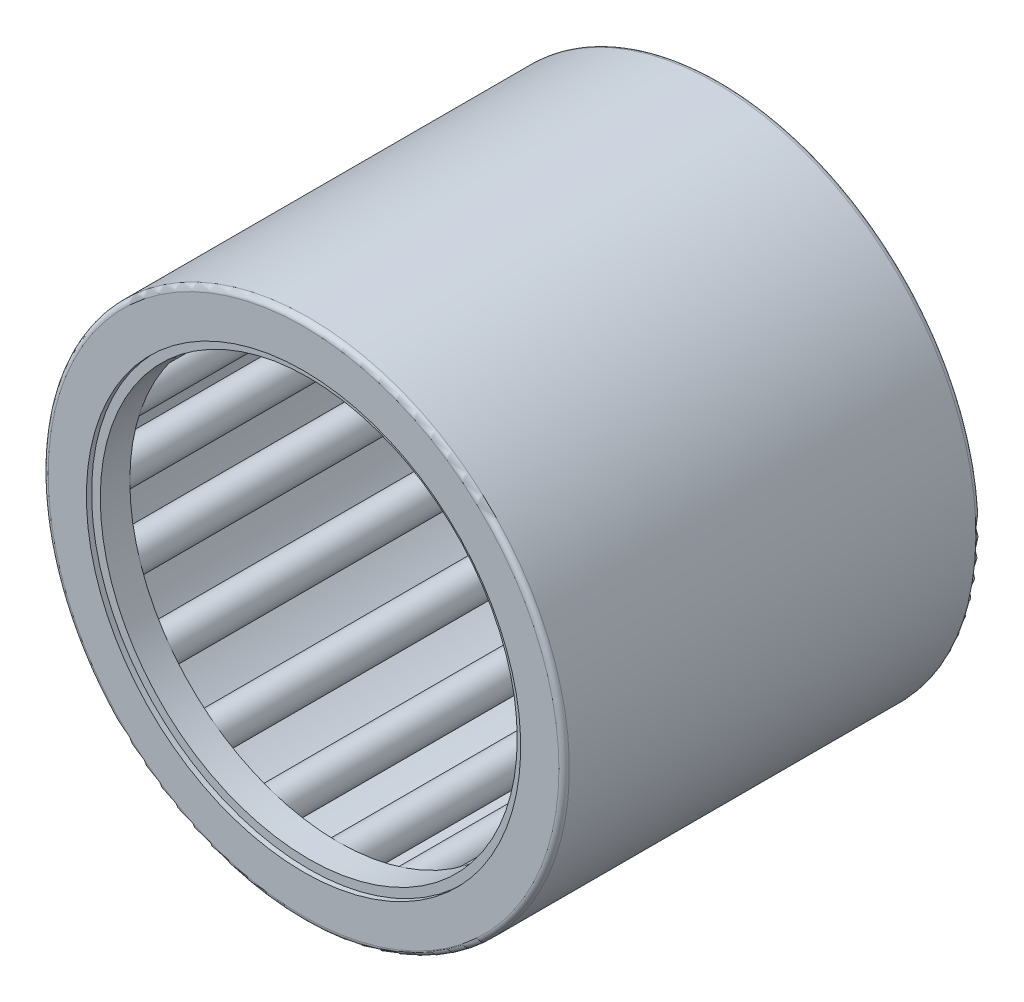
from build123d import *

# Parameters (mm, degrees)
SKETCH2_W         = 21.166666666
SKETCH2_H         = 0.79375
SKETCH3_W         = 23.283333334
SKETCH3_H         = 0.264583334
CIRPATTERN1_COUNT = 20
CIRPATTERN1_ANGLE = 342
FILLET1_R         = 0.3175
SKETCH4_W         = 1.799166667
SKETCH4_H         = 0.529166667
SKETCH5_W         = 1.799166667
SKETCH5_H         = 0.529166667


with BuildPart() as part:
    # Sketch1 → Revolve1 (revolve)
    with BuildSketch(Plane(origin=(0, 0, 0), x_dir=(0, 0, -1), z_dir=(1, 0, 0)), mode=Mode.PRIVATE) as revolve1_sk:
        Polygon((-12.7, 15.875), (12.7, 15.875), (12.7, 13.229166667), (11.641666667, 13.229166667), (11.641666667, 14.816666667), (-11.641666667, 14.816666667), (-11.641666667, 13.229166667), (-12.7, 13.229166667), align=None)
    revolve(revolve1_sk.sketch.rotate(Axis((0, 0, 12.7), (0, 0, -1)), 180), axis=Axis((0, 0, 12.7), (0, 0, -1)))

    # Fillet1
    fillet1_edges = [part.edges().sort_by_distance(p)[0] for p in [
        (0, 15.875, 12.7),
        (0, 15.875, -12.7),
    ]]
    fillet(fillet1_edges, radius=FILLET1_R)


with BuildPart() as body_2:
    # Sketch2 → Revolve2 (revolve)
    with BuildSketch(Plane(origin=(0, 0, 0), x_dir=(0, 0, -1), z_dir=(1, 0, 0)), mode=Mode.PRIVATE) as revolve2_sk:
        with Locations((0, 14.419791667)):
            Rectangle(SKETCH2_W, SKETCH2_H)
    revolve(revolve2_sk.sketch.rotate(Axis((0, 13.758333333, 10.583333333), (0, 0, -1)), 180), axis=Axis((0, 13.758333333, 10.583333333), (0, 0, -1)))


with BuildPart() as body_3:
    # Sketch3 → Revolve3 (revolve)
    with BuildSketch(Plane(origin=(0, 0, 0), x_dir=(0, 0, -1), z_dir=(1, 0, 0)), mode=Mode.PRIVATE) as revolve3_sk:
        with Locations((0, 13.890625)):
            Rectangle(SKETCH3_W, SKETCH3_H)
    revolve(revolve3_sk.sketch.rotate(Axis((0, 13.758333333, 11.641666667), (0, 0, -1)), 90), axis=Axis((0, 13.758333333, 11.641666667), (0, 0, -1)))


with BuildPart() as cirpattern1_1:
    # CirPattern1: pattern copy
    add(body_2.part.rotate(Axis((0, 0, -12.7), (0, 0, 1)), 1 * CIRPATTERN1_ANGLE / (CIRPATTERN1_COUNT - 1)))


with BuildPart() as cirpattern1_2:
    # CirPattern1: pattern copy
    add(body_2.part.rotate(Axis((0, 0, -12.7), (0, 0, 1)), 2 * CIRPATTERN1_ANGLE / (CIRPATTERN1_COUNT - 1)))


with BuildPart() as cirpattern1_3:
    # CirPattern1: pattern copy
    add(body_2.part.rotate(Axis((0, 0, -12.7), (0, 0, 1)), 3 * CIRPATTERN1_ANGLE / (CIRPATTERN1_COUNT - 1)))


with BuildPart() as cirpattern1_4:
    # CirPattern1: pattern copy
    add(body_2.part.rotate(Axis((0, 0, -12.7), (0, 0, 1)), 4 * CIRPATTERN1_ANGLE / (CIRPATTERN1_COUNT - 1)))


with BuildPart() as cirpattern1_5:
    # CirPattern1: pattern copy
    add(body_2.part.rotate(Axis((0, 0, -12.7), (0, 0, 1)), 5 * CIRPATTERN1_ANGLE / (CIRPATTERN1_COUNT - 1)))


with BuildPart() as cirpattern1_6:
    # CirPattern1: pattern copy
    add(body_2.part.rotate(Axis((0, 0, -12.7), (0, 0, 1)), 6 * CIRPATTERN1_ANGLE / (CIRPATTERN1_COUNT - 1)))


with BuildPart() as cirpattern1_7:
    # CirPattern1: pattern copy
    add(body_2.part.rotate(Axis((0, 0, -12.7), (0, 0, 1)), 7 * CIRPATTERN1_ANGLE / (CIRPATTERN1_COUNT - 1)))


with BuildPart() as cirpattern1_8:
    # CirPattern1: pattern copy
    add(body_2.part.rotate(Axis((0, 0, -12.7), (0, 0, 1)), 8 * CIRPATTERN1_ANGLE / (CIRPATTERN1_COUNT - 1)))


with BuildPart() as cirpattern1_9:
    # CirPattern1: pattern copy
    add(body_2.part.rotate(Axis((0, 0, -12.7), (0, 0, 1)), 9 * CIRPATTERN1_ANGLE / (CIRPATTERN1_COUNT - 1)))


with BuildPart() as cirpattern1_10:
    # CirPattern1: pattern copy
    add(body_2.part.rotate(Axis((0, 0, -12.7), (0, 0, 1)), 10 * CIRPATTERN1_ANGLE / (CIRPATTERN1_COUNT - 1)))


with BuildPart() as cirpattern1_11:
    # CirPattern1: pattern copy
    add(body_2.part.rotate(Axis((0, 0, -12.7), (0, 0, 1)), 11 * CIRPATTERN1_ANGLE / (CIRPATTERN1_COUNT - 1)))


with BuildPart() as cirpattern1_12:
    # CirPattern1: pattern copy
    add(body_2.part.rotate(Axis((0, 0, -12.7), (0, 0, 1)), 12 * CIRPATTERN1_ANGLE / (CIRPATTERN1_COUNT - 1)))


with BuildPart() as cirpattern1_13:
    # CirPattern1: pattern copy
    add(body_2.part.rotate(Axis((0, 0, -12.7), (0, 0, 1)), 13 * CIRPATTERN1_ANGLE / (CIRPATTERN1_COUNT - 1)))


with BuildPart() as cirpattern1_14:
    # CirPattern1: pattern copy
    add(body_2.part.rotate(Axis((0, 0, -12.7), (0, 0, 1)), 14 * CIRPATTERN1_ANGLE / (CIRPATTERN1_COUNT - 1)))


with BuildPart() as cirpattern1_15:
    # CirPattern1: pattern copy
    add(body_2.part.rotate(Axis((0, 0, -12.7), (0, 0, 1)), 15 * CIRPATTERN1_ANGLE / (CIRPATTERN1_COUNT - 1)))


with BuildPart() as cirpattern1_16:
    # CirPattern1: pattern copy
    add(body_2.part.rotate(Axis((0, 0, -12.7), (0, 0, 1)), 16 * CIRPATTERN1_ANGLE / (CIRPATTERN1_COUNT - 1)))


with BuildPart() as cirpattern1_17:
    # CirPattern1: pattern copy
    add(body_2.part.rotate(Axis((0, 0, -12.7), (0, 0, 1)), 17 * CIRPATTERN1_ANGLE / (CIRPATTERN1_COUNT - 1)))


with BuildPart() as cirpattern1_18:
    # CirPattern1: pattern copy
    add(body_2.part.rotate(Axis((0, 0, -12.7), (0, 0, 1)), 18 * CIRPATTERN1_ANGLE / (CIRPATTERN1_COUNT - 1)))


with BuildPart() as cirpattern1_19:
    # CirPattern1: pattern copy
    add(body_2.part.rotate(Axis((0, 0, -12.7), (0, 0, 1)), 19 * CIRPATTERN1_ANGLE / (CIRPATTERN1_COUNT - 1)))


with BuildPart() as cirpattern1_20:
    # CirPattern1: pattern copy
    add(body_3.part.rotate(Axis((0, 0, -12.7), (0, 0, 1)), 1 * CIRPATTERN1_ANGLE / (CIRPATTERN1_COUNT - 1)))


with BuildPart() as cirpattern1_21:
    # CirPattern1: pattern copy
    add(body_3.part.rotate(Axis((0, 0, -12.7), (0, 0, 1)), 2 * CIRPATTERN1_ANGLE / (CIRPATTERN1_COUNT - 1)))


with BuildPart() as cirpattern1_22:
    # CirPattern1: pattern copy
    add(body_3.part.rotate(Axis((0, 0, -12.7), (0, 0, 1)), 3 * CIRPATTERN1_ANGLE / (CIRPATTERN1_COUNT - 1)))


with BuildPart() as cirpattern1_23:
    # CirPattern1: pattern copy
    add(body_3.part.rotate(Axis((0, 0, -12.7), (0, 0, 1)), 4 * CIRPATTERN1_ANGLE / (CIRPATTERN1_COUNT - 1)))


with BuildPart() as cirpattern1_24:
    # CirPattern1: pattern copy
    add(body_3.part.rotate(Axis((0, 0, -12.7), (0, 0, 1)), 5 * CIRPATTERN1_ANGLE / (CIRPATTERN1_COUNT - 1)))


with BuildPart() as cirpattern1_25:
    # CirPattern1: pattern copy
    add(body_3.part.rotate(Axis((0, 0, -12.7), (0, 0, 1)), 6 * CIRPATTERN1_ANGLE / (CIRPATTERN1_COUNT - 1)))


with BuildPart() as cirpattern1_26:
    # CirPattern1: pattern copy
    add(body_3.part.rotate(Axis((0, 0, -12.7), (0, 0, 1)), 7 * CIRPATTERN1_ANGLE / (CIRPATTERN1_COUNT - 1)))


with BuildPart() as cirpattern1_27:
    # CirPattern1: pattern copy
    add(body_3.part.rotate(Axis((0, 0, -12.7), (0, 0, 1)), 8 * CIRPATTERN1_ANGLE / (CIRPATTERN1_COUNT - 1)))


with BuildPart() as cirpattern1_28:
    # CirPattern1: pattern copy
    add(body_3.part.rotate(Axis((0, 0, -12.7), (0, 0, 1)), 9 * CIRPATTERN1_ANGLE / (CIRPATTERN1_COUNT - 1)))


with BuildPart() as cirpattern1_29:
    # CirPattern1: pattern copy
    add(body_3.part.rotate(Axis((0, 0, -12.7), (0, 0, 1)), 10 * CIRPATTERN1_ANGLE / (CIRPATTERN1_COUNT - 1)))


with BuildPart() as cirpattern1_30:
    # CirPattern1: pattern copy
    add(body_3.part.rotate(Axis((0, 0, -12.7), (0, 0, 1)), 11 * CIRPATTERN1_ANGLE / (CIRPATTERN1_COUNT - 1)))


with BuildPart() as cirpattern1_31:
    # CirPattern1: pattern copy
    add(body_3.part.rotate(Axis((0, 0, -12.7), (0, 0, 1)), 12 * CIRPATTERN1_ANGLE / (CIRPATTERN1_COUNT - 1)))


with BuildPart() as cirpattern1_32:
    # CirPattern1: pattern copy
    add(body_3.part.rotate(Axis((0, 0, -12.7), (0, 0, 1)), 13 * CIRPATTERN1_ANGLE / (CIRPATTERN1_COUNT - 1)))


with BuildPart() as cirpattern1_33:
    # CirPattern1: pattern copy
    add(body_3.part.rotate(Axis((0, 0, -12.7), (0, 0, 1)), 14 * CIRPATTERN1_ANGLE / (CIRPATTERN1_COUNT - 1)))


with BuildPart() as cirpattern1_34:
    # CirPattern1: pattern copy
    add(body_3.part.rotate(Axis((0, 0, -12.7), (0, 0, 1)), 15 * CIRPATTERN1_ANGLE / (CIRPATTERN1_COUNT - 1)))


with BuildPart() as cirpattern1_35:
    # CirPattern1: pattern copy
    add(body_3.part.rotate(Axis((0, 0, -12.7), (0, 0, 1)), 16 * CIRPATTERN1_ANGLE / (CIRPATTERN1_COUNT - 1)))


with BuildPart() as cirpattern1_36:
    # CirPattern1: pattern copy
    add(body_3.part.rotate(Axis((0, 0, -12.7), (0, 0, 1)), 17 * CIRPATTERN1_ANGLE / (CIRPATTERN1_COUNT - 1)))


with BuildPart() as cirpattern1_37:
    # CirPattern1: pattern copy
    add(body_3.part.rotate(Axis((0, 0, -12.7), (0, 0, 1)), 18 * CIRPATTERN1_ANGLE / (CIRPATTERN1_COUNT - 1)))


with BuildPart() as cirpattern1_38:
    # CirPattern1: pattern copy
    add(body_3.part.rotate(Axis((0, 0, -12.7), (0, 0, 1)), 19 * CIRPATTERN1_ANGLE / (CIRPATTERN1_COUNT - 1)))


with BuildPart() as body_42:
    # Sketch4 → Revolve4 (revolve)
    with BuildSketch(Plane(origin=(0, 0, 0), x_dir=(0, 0, -1), z_dir=(1, 0, 0)), mode=Mode.PRIVATE) as revolve4_sk:
        with Locations((11.482916666, 12.964583334)):
            Rectangle(SKETCH4_W, SKETCH4_H)
    revolve(revolve4_sk.sketch.rotate(Axis((0, 0, 12.7), (0, 0, -1)), 180), axis=Axis((0, 0, 12.7), (0, 0, -1)))


with BuildPart() as body_43:
    # Sketch5 → Revolve5 (revolve)
    with BuildSketch(Plane(origin=(0, 0, 0), x_dir=(0, 0, -1), z_dir=(1, 0, 0)), mode=Mode.PRIVATE) as revolve5_sk:
        with Locations((-11.482916666, 12.964583334)):
            Rectangle(SKETCH5_W, SKETCH5_H)
    revolve(revolve5_sk.sketch.rotate(Axis((0, 0, 12.7), (0, 0, -1)), 180), axis=Axis((0, 0, 12.7), (0, 0, -1)))


solid = Compound([part.part, body_2.part, body_3.part, cirpattern1_1.part, cirpattern1_2.part, cirpattern1_3.part, cirpattern1_4.part, cirpattern1_5.part, cirpattern1_6.part, cirpattern1_7.part, cirpattern1_8.part, cirpattern1_9.part, cirpattern1_10.part, cirpattern1_11.part, cirpattern1_12.part, cirpattern1_13.part, cirpattern1_14.part, cirpattern1_15.part, cirpattern1_16.part, cirpattern1_17.part, cirpattern1_18.part, cirpattern1_19.part, cirpattern1_20.part, cirpattern1_21.part, cirpattern1_22.part, cirpattern1_23.part, cirpattern1_24.part, cirpattern1_25.part, cirpattern1_26.part, cirpattern1_27.part, cirpattern1_28.part, cirpattern1_29.part, cirpattern1_30.part, cirpattern1_31.part, cirpattern1_32.part, cirpattern1_33.part, cirpattern1_34.part, cirpattern1_35.part, cirpattern1_36.part, cirpattern1_37.part, cirpattern1_38.part, body_42.part, body_43.part])
